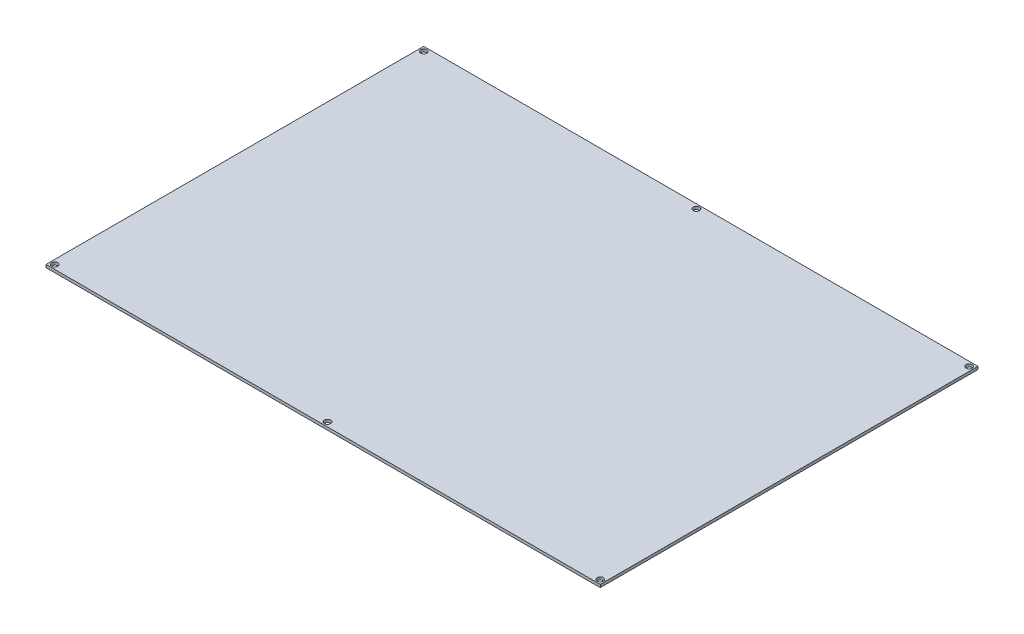
from build123d import *

# Parameters (mm, degrees)
SKETCH1_W           = 314
SKETCH1_H           = 214
BOSS_EXTRUDE1_DEPTH = 1.6
SKETCH2_R           = 1.75
CUT_EXTRUDE1_DEPTH  = 380.992842038


with BuildPart() as part:
    # Sketch1 → Boss-Extrude1 (new body)
    with BuildSketch(Plane(origin=(0, 0, 0), x_dir=(1, 0, 0), z_dir=(0, 1, 0))):
        with Locations((157, 107)):
            Rectangle(SKETCH1_W, SKETCH1_H)
    extrude(amount=BOSS_EXTRUDE1_DEPTH)

    # Sketch2 → Cut-Extrude1 (cut, through all)
    with BuildSketch(Plane(origin=(0, 1.6, 0), x_dir=(1, 0, 0), z_dir=(0, 1, 0))):
        with Locations(Location((2.5, 2.5, 0), (0, 0, 270))):
            Circle(SKETCH2_R)
        with Locations(Location((311.5, 2.5, 0), (0, 0, 270))):
            Circle(SKETCH2_R)
        with Locations(Location((2.5, 211.5, 0), (0, 0, 270))):
            Circle(SKETCH2_R)
        with Locations(Location((311.5, 211.5, 0), (0, 0, 270))):
            Circle(SKETCH2_R)
        with Locations(Location((157, 2.5, 0), (0, 0, 270))):
            Circle(SKETCH2_R)
        with Locations(Location((157, 211.5, 0), (0, 0, 270))):
            Circle(SKETCH2_R)
    extrude(amount=-CUT_EXTRUDE1_DEPTH, mode=Mode.SUBTRACT)


solid = part.part
